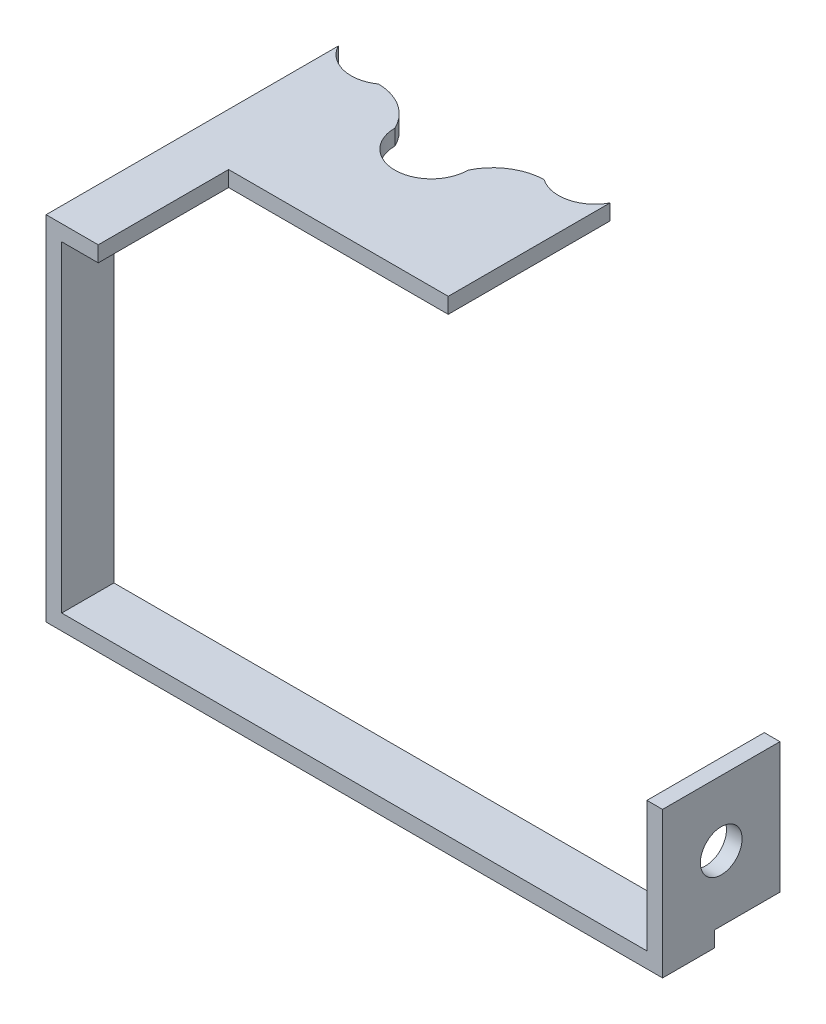
from build123d import *

# Parameters (mm, degrees)
BOSS_EXTRUDE1_DEPTH = 3
SKETCH6_W           = 10
SKETCH6_H           = 3
BOSS_EXTRUDE5_DEPTH = 25
SKETCH8_W           = 3
SKETCH8_H           = 10
BOSS_EXTRUDE7_DEPTH = 64.65
SKETCH9_W           = 10
SKETCH9_H           = 3
BOSS_EXTRUDE8_DEPTH = 115.212
SKETCH10_W          = 3
SKETCH10_H          = 22.5
BOSS_EXTRUDE9_DEPTH = 25
SKETCH11_R          = 4
CUT_EXTRUDE1_DEPTH  = 3


with BuildPart() as part:
    # Sketch2 → Boss-Extrude1 (new body)
    with BuildSketch(Plane(origin=(0, 0, 0), x_dir=(1, 0, 0), z_dir=(0, 1, 0))):
        with BuildLine():
            Line((26.055569119, 8.188046441), (26.055569119, -22.834953559))
            Line((26.055569119, -22.834953559), (-26.055569119, -22.834953559))
            Line((-26.055569119, -22.834953559), (-26.055569119, 8.188046441))
            ThreePointArc((-26.055569119, 8.188046441), (-21.514872246, 4.669726518), (-15.870079226, 5.73406431))
            ThreePointArc((-15.870079226, 5.73406431), (-10.616247764, 4.133629141), (-7, 0))
            ThreePointArc((-7, 0), (0, -7), (7, 0))
            ThreePointArc((7, 0), (10.616247764, 4.133629141), (15.870079226, 5.73406431))
            ThreePointArc((15.870079226, 5.73406431), (21.514872246, 4.669726518), (26.055569119, 8.188046441))
        make_face()
    extrude(amount=BOSS_EXTRUDE1_DEPTH)

    # Sketch6 → Boss-Extrude5 (add)
    with BuildSketch(Plane.XY.offset(22.834953559)):
        with Locations((-21.055569119, 1.5)):
            Rectangle(SKETCH6_W, SKETCH6_H)
    extrude(amount=BOSS_EXTRUDE5_DEPTH)

    # Sketch8 → Boss-Extrude7 (add)
    with BuildSketch(Plane(origin=(0, 0, 0), x_dir=(-1, 0, 0), z_dir=(0, -1, 0))):
        with Locations((24.555569119, -42.834953559)):
            Rectangle(SKETCH8_W, SKETCH8_H)
    extrude(amount=BOSS_EXTRUDE7_DEPTH)

    # Sketch9 → Boss-Extrude8 (add)
    with BuildSketch(Plane(origin=(-23.055569119, 0, 0), x_dir=(0, 0, -1), z_dir=(1, 0, 0))):
        with Locations((-42.834953559, -63.15)):
            Rectangle(SKETCH9_W, SKETCH9_H)
    extrude(amount=BOSS_EXTRUDE8_DEPTH)

    # Sketch10 → Boss-Extrude9 (add)
    with BuildSketch(Plane(origin=(0, -61.65, 0), x_dir=(1, 0, 0), z_dir=(0, 1, 0))):
        with Locations((90.656430881, -36.584953559)):
            Rectangle(SKETCH10_W, SKETCH10_H)
    extrude(amount=BOSS_EXTRUDE9_DEPTH)

    # Sketch11 → Cut-Extrude1 (cut)
    with BuildSketch(Plane(origin=(92.156430881, 0, 0), x_dir=(0, 0, -1), z_dir=(1, 0, 0))):
        with Locations((-36.584953559, -49.15)):
            Circle(SKETCH11_R)
    extrude(amount=-CUT_EXTRUDE1_DEPTH, mode=Mode.SUBTRACT)


solid = part.part
